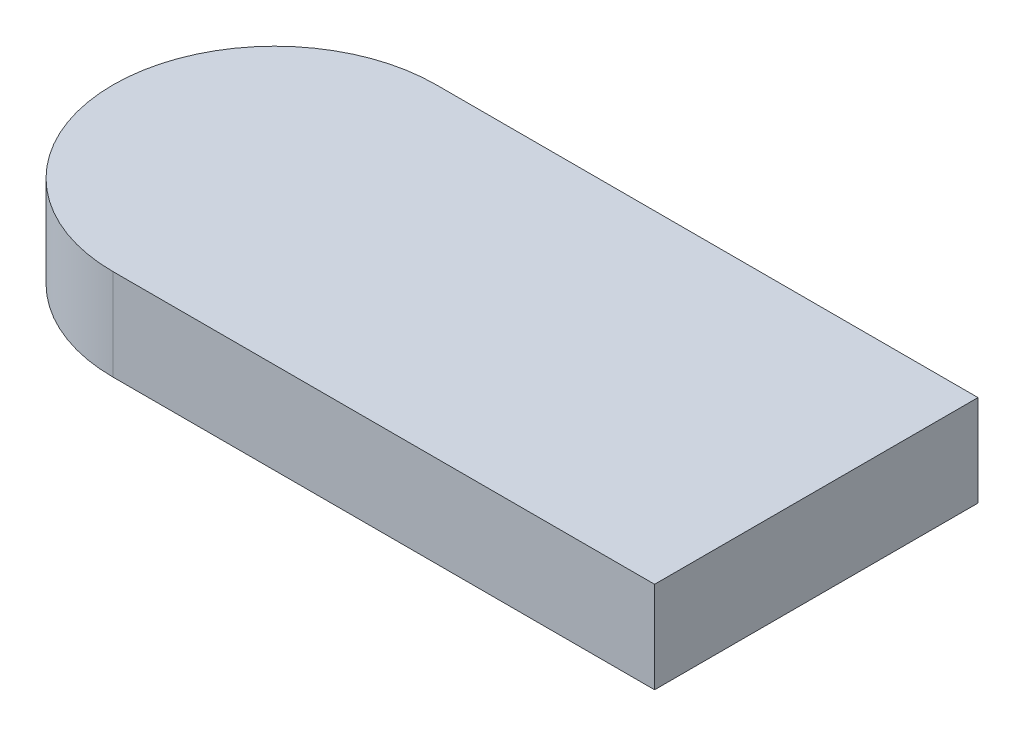
from build123d import *
from OCP.BRepFilletAPI import BRepFilletAPI_MakeChamfer

# Parameters (mm, degrees)
BOSS_EXTRUDE1_DEPTH = 3
BOSS_EXTRUDE3_START = -15
BOSS_EXTRUDE3_DEPTH = 15
CHAMFER2_SIZE       = 2
CHAMFER2_SIZE2      = 2.965121937


with BuildPart() as part:
    # Sketch1 → Boss-Extrude1 (new body)
    with BuildSketch(Plane(origin=(0, 0, 0), x_dir=(1, 0, 0), z_dir=(0, 1, 0))):
        with BuildLine():
            Line((20.272183792, 10.837794599), (-53.767816208, 10.837794599))
            ThreePointArc((-53.767816208, 10.837794599), (-39.625680584, 4.979930223), (-33.767816208, -9.162205401))
            ThreePointArc((-33.767816208, -9.162205401), (-39.625680584, -23.304341024), (-53.767816208, -29.162205401))
            Line((-53.767816208, -29.162205401), (20.272183792, -29.162205401))
            Line((20.272183792, -29.162205401), (20.272183792, 10.837794599))
        make_face()
        with BuildLine():
            ThreePointArc((-33.767816208, -9.162205401), (-39.625680584, 4.979930223), (-53.767816208, 10.837794599))
            Line((-53.767816208, 10.837794599), (-53.767816208, -29.162205401))
            ThreePointArc((-53.767816208, -29.162205401), (-39.625680584, -23.304341024), (-33.767816208, -9.162205401))
        make_face()
        with BuildLine():
            Line((-53.767816208, -29.162205401), (-53.767816208, 10.837794599))
            ThreePointArc((-53.767816208, 10.837794599), (-73.767816208, -9.162205401), (-53.767816208, -29.162205401))
        make_face()
        with BuildLine():
            ThreePointArc((-33.767816208, -9.162205401), (-39.625680584, 4.979930223), (-53.767816208, 10.837794599))
            Line((-53.767816208, 10.837794599), (-53.767816208, -29.162205401))
            ThreePointArc((-53.767816208, -29.162205401), (-39.625680584, -23.304341024), (-33.767816208, -9.162205401))
        make_face()
        with BuildLine():
            Line((-53.767816208, -29.162205401), (-53.767816208, 10.837794599))
            ThreePointArc((-53.767816208, 10.837794599), (-73.767816208, -9.162205401), (-53.767816208, -29.162205401))
        make_face()
    extrude(amount=BOSS_EXTRUDE1_DEPTH)

    # Sketch2 → Boss-Extrude3 (add)
    with BuildSketch(Plane(origin=(0, 3, 0), x_dir=(1, 0, 0), z_dir=(0, 1, 0)).offset(BOSS_EXTRUDE3_START)):
        with BuildLine():
            ThreePointArc((-53.767816208, -29.162205401), (-73.767816208, -9.162205401), (-53.767816208, 10.837794599))
            Line((-53.767816208, 10.837794599), (-53.767816208, 13.837794599))
            ThreePointArc((-53.767816208, 13.837794599), (-76.767816208, -9.162205401), (-53.767816208, -32.162205401))
            Line((-53.767816208, -32.162205401), (-53.767816208, -29.162205401))
        make_face()
        with BuildLine():
            Line((-53.767816208, 13.837794599), (-53.767816208, 10.837794599))
            Line((-53.767816208, 10.837794599), (-42.409999516, 10.837794599))
            ThreePointArc((-42.409999516, 10.837794599), (-47.894146145, 13.075150557), (-53.767816208, 13.837794599))
        make_face()
        with BuildLine():
            Line((-42.409999516, -29.162205401), (-53.767816208, -29.162205401))
            Line((-53.767816208, -29.162205401), (-53.767816208, -32.162205401))
            ThreePointArc((-53.767816208, -32.162205401), (-47.894146145, -31.399561359), (-42.409999516, -29.162205401))
        make_face()
        with BuildLine():
            Line((23.272183792, 13.837794599), (-53.767816208, 13.837794599))
            ThreePointArc((-53.767816208, 13.837794599), (-47.894146145, 13.075150557), (-42.409999516, 10.837794599))
            Line((-42.409999516, 10.837794599), (20.272183792, 10.837794599))
            Line((20.272183792, 10.837794599), (20.272183792, -29.162205401))
            Line((20.272183792, -29.162205401), (-42.409999516, -29.162205401))
            ThreePointArc((-42.409999516, -29.162205401), (-47.894146145, -31.399561359), (-53.767816208, -32.162205401))
            Line((-53.767816208, -32.162205401), (23.272183792, -32.162205401))
            Line((23.272183792, -32.162205401), (23.272183792, 13.837794599))
        make_face()
    extrude(amount=BOSS_EXTRUDE3_DEPTH)

    # Chamfer2: one chamfer whose edges measure the first distance from different faces: ONE call of the kernel's chamfer builder (chamfer() names one face for all edges)
    chamfer2_edges_1 = [part.edges().sort_by_distance(p)[0] for p in [
        (-76.767816208, -12, 9.162205401),
    ]]
    chamfer2_side_1 = [part.faces().sort_by_distance(p)[0] for p in [
        (-76.767816208, -4.5, 9.162205401),
    ]]
    chamfer2_edges_2 = [part.edges().sort_by_distance(p)[0] for p in [
        (-15.247816208, -12, -13.837794599),
    ]]
    chamfer2_side_2 = [part.faces().sort_by_distance(p)[0] for p in [
        (-15.247816208, -4.5, -13.837794599),
    ]]
    chamfer2_edges_3 = [part.edges().sort_by_distance(p)[0] for p in [
        (23.272183792, -12, 9.162205401),
    ]]
    chamfer2_side_3 = [part.faces().sort_by_distance(p)[0] for p in [
        (23.272183792, -4.5, 9.162205401),
    ]]
    chamfer2_edges_4 = [part.edges().sort_by_distance(p)[0] for p in [
        (-15.247816208, -12, 32.162205401),
    ]]
    chamfer2_side_4 = [part.faces().sort_by_distance(p)[0] for p in [
        (-15.247816208, -4.5, 32.162205401),
    ]]
    chamfer2 = BRepFilletAPI_MakeChamfer(part.part.solid().wrapped)
    for e in chamfer2_edges_1:
        chamfer2.Add(CHAMFER2_SIZE, CHAMFER2_SIZE2, e.wrapped, chamfer2_side_1[0].wrapped)  # the first distance lies on this face
    for e in chamfer2_edges_2:
        chamfer2.Add(CHAMFER2_SIZE, CHAMFER2_SIZE2, e.wrapped, chamfer2_side_2[0].wrapped)  # the first distance lies on this face
    for e in chamfer2_edges_3:
        chamfer2.Add(CHAMFER2_SIZE, CHAMFER2_SIZE2, e.wrapped, chamfer2_side_3[0].wrapped)  # the first distance lies on this face
    for e in chamfer2_edges_4:
        chamfer2.Add(CHAMFER2_SIZE, CHAMFER2_SIZE2, e.wrapped, chamfer2_side_4[0].wrapped)  # the first distance lies on this face
    add(Compound.cast(chamfer2.Shape()), mode=Mode.REPLACE)


solid = part.part
